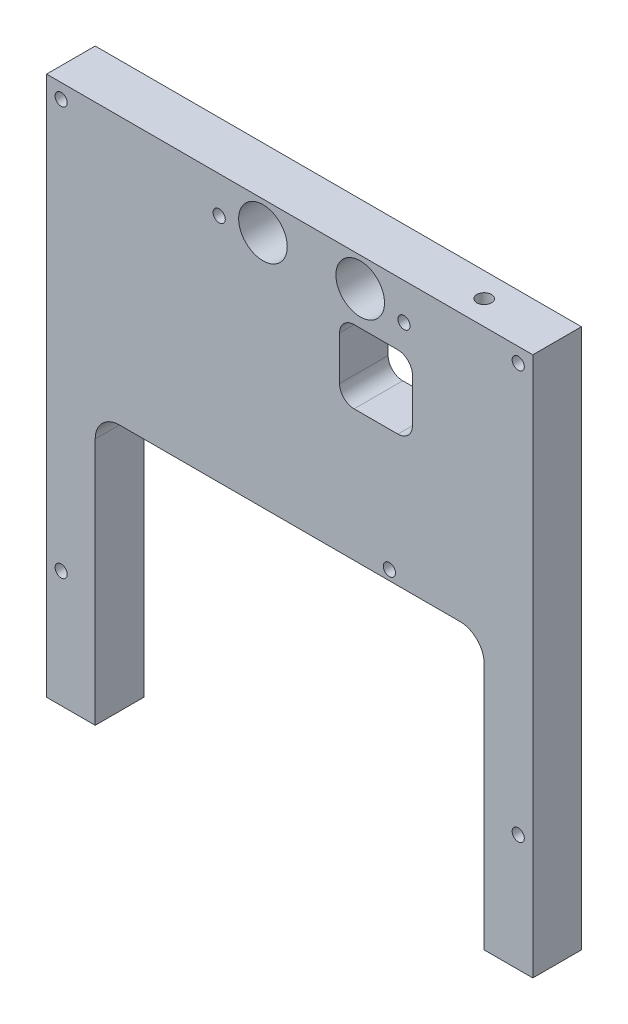
from build123d import *

# Parameters (mm, degrees)
EXTRUSION1_DEPTH          = 10
TROU_TARAUD_M4X0_71_D     = 3.3
TROU_TARAUD_M4X0_71_DEPTH = 15
TROU_TARAUD_M4X0_71_TIP   = 0.991420021
ESQUISSE4_R               = 5
ENL_V_MAT_EXTRU_1_DEPTH   = 131.384048104
TROU_TARAUD_M31_D         = 2.5
ESQUISSE7_R               = 1.5
ENL_V_MAT_EXTRU_2_DEPTH   = 10


with BuildPart() as part:
    # Esquisse1 → Extrusion1 (new body)
    with BuildSketch(Plane.XY):
        with BuildLine():
            Line((-40, 9), (-50, 9))
            Line((-50, 9), (-50, 120))
            Line((-50, 120), (50, 120))
            Line((50, 120), (50, 9))
            Line((50, 9), (40, 9))
            Line((40, 9), (40, 60))
            ThreePointArc((40, 60), (38.535533906, 63.535533906), (35, 65))
            Line((35, 65), (-35, 65))
            ThreePointArc((-35, 65), (-38.535533906, 63.535533906), (-40, 60))
            Line((-40, 60), (-40, 9))
        make_face()
    extrude(amount=EXTRUSION1_DEPTH)

    # Trou taraudé M4x0.71
    with Locations(Plane.XZ.offset(-9)):
        with Locations((-45, 5), (45, 5)):
            Hole(TROU_TARAUD_M4X0_71_D / 2, depth=TROU_TARAUD_M4X0_71_DEPTH)
            with Locations((0, 0, -(TROU_TARAUD_M4X0_71_DEPTH + TROU_TARAUD_M4X0_71_TIP / 2))):  # 118° drill point
                Cone(0, TROU_TARAUD_M4X0_71_D / 2, TROU_TARAUD_M4X0_71_TIP, mode=Mode.SUBTRACT)

    # Esquisse4 → Enlèv. mat.-Extru.1 (cut, through all)
    with BuildSketch(Plane.XY):
        with Locations((14.5, 114)):
            Circle(ESQUISSE4_R)
        with Locations((-5.5, 114)):
            Circle(ESQUISSE4_R)
        with BuildLine():
            Line((22.25, 107), (13.25, 107))
            ThreePointArc((13.25, 107), (11.128679656, 106.121320344), (10.25, 104))
            Line((10.25, 104), (10.25, 95))
            ThreePointArc((10.25, 95), (11.128679656, 92.878679656), (13.25, 92))
            Line((13.25, 92), (22.25, 92))
            ThreePointArc((22.25, 92), (24.371320344, 92.878679656), (25.25, 95))
            Line((25.25, 95), (25.25, 104))
            ThreePointArc((25.25, 104), (24.371320344, 106.121320344), (22.25, 107))
        make_face()
    extrude(amount=ENL_V_MAT_EXTRU_1_DEPTH, mode=Mode.SUBTRACT)

    # Trou taraudé M31 (through all)
    with Locations(Plane(origin=(0, 0, 0), x_dir=(-1, 0, 0), z_dir=(0, 0, -1))):
        with Locations((-23.5, 112.5), (14.5, 112.5), (-20.5, 67), (-47, 117), (47, 117), (47, 33), (-47, 33)):
            Hole(TROU_TARAUD_M31_D / 2)

    # Esquisse7 → Enlèv. mat.-Extru.2 (cut)
    with BuildSketch(Plane(origin=(0, 120, 0), x_dir=(1, 0, 0), z_dir=(0, 1, 0))):
        with Locations(Location((35, -5, 0), (0, 0, 270))):
            Circle(ESQUISSE7_R)
    extrude(amount=-ENL_V_MAT_EXTRU_2_DEPTH, mode=Mode.SUBTRACT)


solid = part.part
